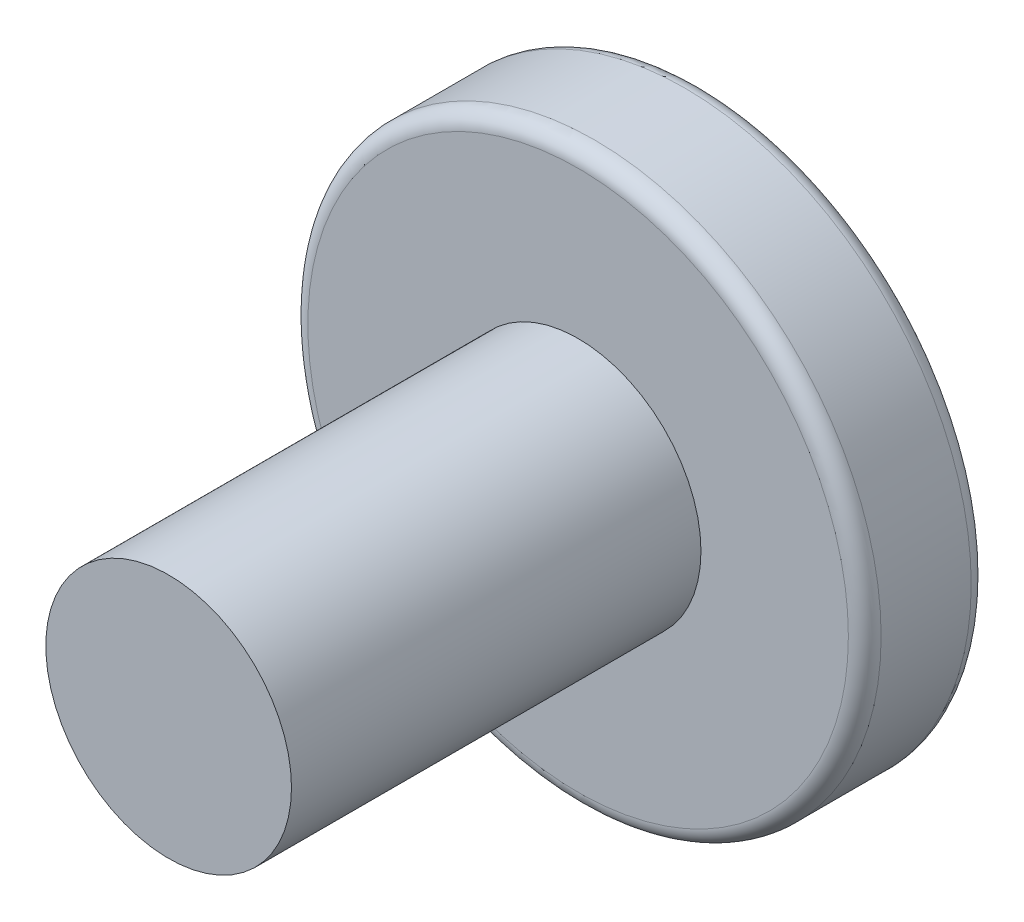
from build123d import *

# Parameters (mm, degrees)
SKETCH_1_R          = 3.5
EXTRUDE_1_DEPTH     = 1.5
SKETCH_2_R          = 1.5
EXTRUDE_2_DEPTH     = 5
FILLET_1_R          = 0.2
CUT_EXTRUDE_1_DEPTH = 1.5


with BuildPart() as part:
    # 草图1 → 凸台-拉伸1 (new body)
    with BuildSketch(Plane.XY):
        Circle(SKETCH_1_R)
    extrude(amount=EXTRUDE_1_DEPTH)

    # 草图2 → 凸台-拉伸2 (add)
    with BuildSketch(Plane.XY.offset(1.5)):
        Circle(SKETCH_2_R)
    extrude(amount=EXTRUDE_2_DEPTH)

    # 圆角1
    fillet_1_edges = [part.edges().sort_by_distance(p)[0] for p in [
        (-3.5, 0, 0),
        (-3.5, 0, 1.5),
    ]]
    fillet(fillet_1_edges, radius=FILLET_1_R)

    # 草图3 → 切除-拉伸1 (cut)
    with BuildSketch(Plane(origin=(0, 0, 0), x_dir=(-1, 0, 0), z_dir=(0, 0, -1))):
        Polygon((1.154700538, 0), (0.577350269, 1), (-0.577350269, 1), (-1.154700538, 0), (-0.577350269, -1), (0.577350269, -1), align=None)
    extrude(amount=-CUT_EXTRUDE_1_DEPTH, mode=Mode.SUBTRACT)


solid = part.part
